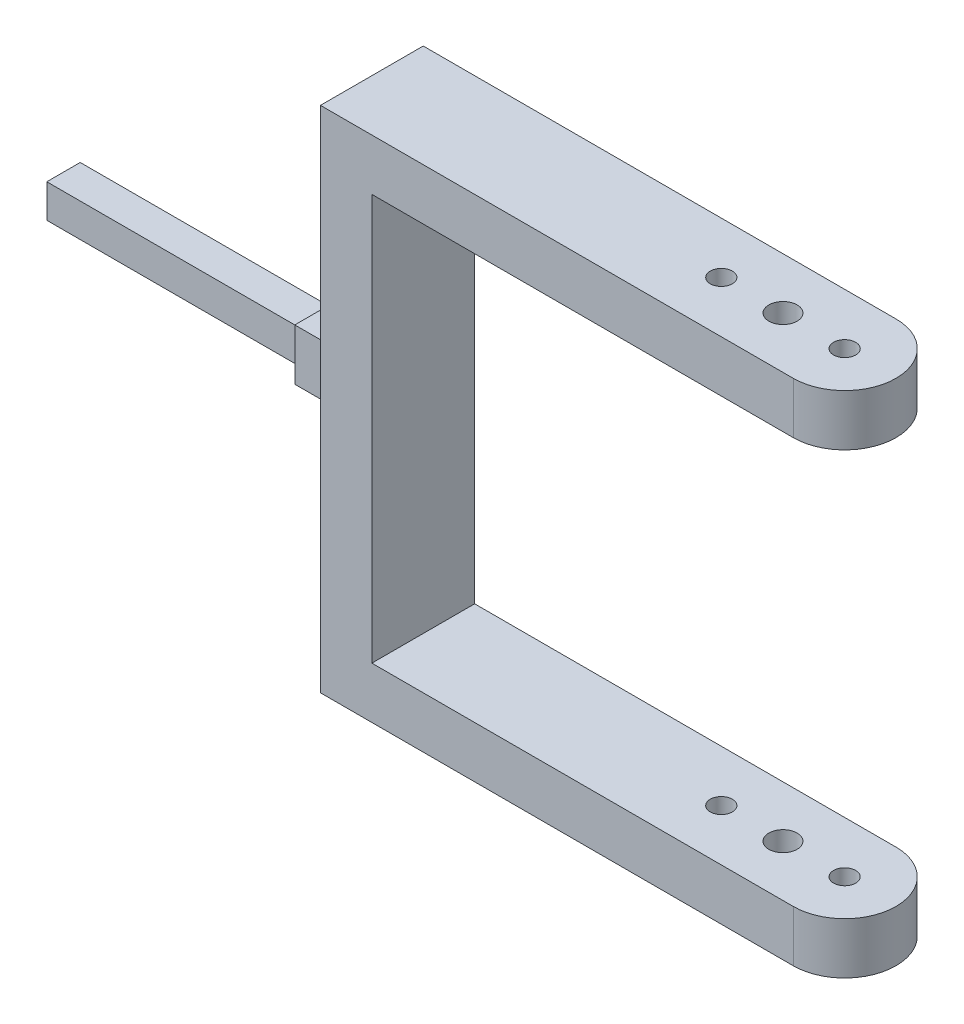
from build123d import *

# Parameters (mm, degrees)
EXTRUDE_1_DEPTH     = 20
SKETCH_3_W          = 10
SKETCH_3_H          = 10
SKETCH_3_W_2        = 6.5
SKETCH_3_H_2        = 6.5
EXTRUDE_2_DEPTH     = 10
EXTRUDE_START       = 10
SKETCH_3_3_W        = 6.5
SKETCH_3_3_H        = 6.5
EXTRUDE_3_DEPTH     = 50
SKETCH_4_W          = 20
SKETCH_4_H          = 10
EXTRUDE_4_DEPTH     = 12
SKETCH_2_R          = 2.15
SKETCH_2_R_2        = 2.75
CUT_EXTRUDE_1_DEPTH = 137.619910701


with BuildPart() as part:
    # 草图1 → 凸台-拉伸1 (new body)
    with BuildSketch(Plane.XY):
        Polygon((0, 39.5), (0, -39.5), (80, -39.5), (80, -49.5), (-10, -49.5), (-10, 49.5), (80, 49.5), (80, 39.5), align=None)
    extrude(amount=EXTRUDE_1_DEPTH)

    # 草图3 → 凸台-拉伸2 (add)
    # profile 1 of 2: a face of its own
    with BuildSketch(Plane.ZY.offset(10)):
        with Locations((10, 0)):
            Rectangle(SKETCH_3_W, SKETCH_3_H)
        with Locations((10, 0)):
            Rectangle(SKETCH_3_W_2, SKETCH_3_H_2, mode=Mode.SUBTRACT)
    # profile 2 of 2: a face of its own
    with BuildSketch(Plane.ZY.offset(10)):
        with Locations((10, 0)):
            Rectangle(SKETCH_3_W_2, SKETCH_3_H_2)
    extrude(amount=EXTRUDE_2_DEPTH)

    # 草图3<3> → 凸台-拉伸3 (add)
    with BuildSketch(Plane.ZY.offset(10).offset(EXTRUDE_START)):
        with Locations((10, 0)):
            Rectangle(SKETCH_3_3_W, SKETCH_3_3_H)
    extrude(amount=EXTRUDE_3_DEPTH)

    # 草图4 → 凸台-拉伸4 (add)
    with BuildSketch(Plane(origin=(80, 0, 0), x_dir=(0, 0, -1), z_dir=(1, 0, 0))):
        with Locations((-10, -44.5)):
            Rectangle(SKETCH_4_W, SKETCH_4_H)
        with Locations((-10, 44.5)):
            Rectangle(SKETCH_4_W, SKETCH_4_H)
    extrude(amount=EXTRUDE_4_DEPTH)

    # 草图2 → 切除-拉伸1 (cut, through all)
    with BuildSketch(Plane(origin=(0, 49.5, 0), x_dir=(1, 0, 0), z_dir=(0, 1, 0))):
        with Locations(Location((82, -10, 0), (0, 0, 180))):
            Circle(SKETCH_2_R)
        with BuildLine():
            Line((92, -20), (92, -10))
            ThreePointArc((92, -10), (89.071067812, -17.071067812), (82, -20))
            Line((82, -20), (92, -20))
        make_face()
        with BuildLine():
            ThreePointArc((82, 0), (89.071067812, -2.928932188), (92, -10))
            Line((92, -10), (92, 0))
            Line((92, 0), (82, 0))
        make_face()
        with Locations(Location((70, -10, 0), (0, 0, 180))):
            Circle(SKETCH_2_R_2)
        with Locations(Location((58, -10, 0), (0, 0, 180))):
            Circle(SKETCH_2_R)
    extrude(amount=-CUT_EXTRUDE_1_DEPTH, mode=Mode.SUBTRACT)


solid = part.part
